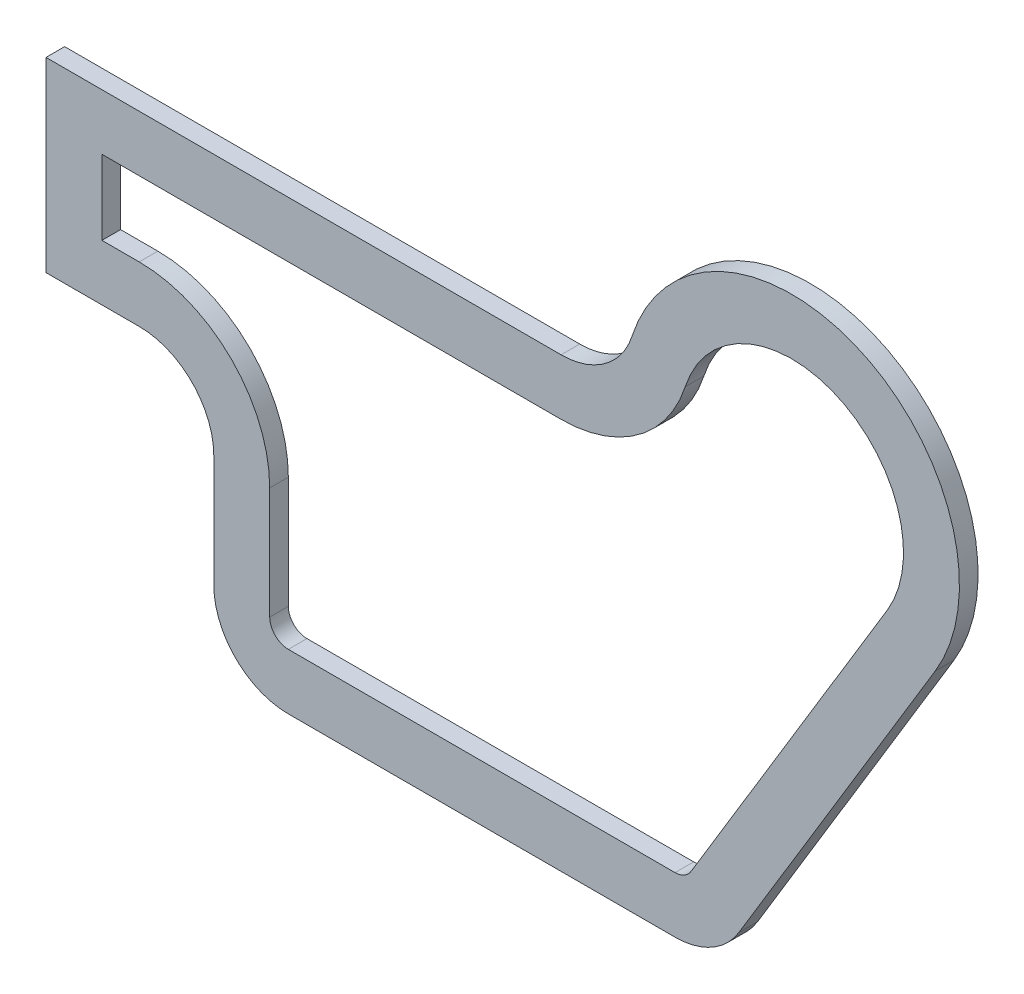
from build123d import *

# Parameters (mm, degrees)
BASE_DEPTH         = 5
CUT_EXTRUDE1_DEPTH = 260.326049598


with BuildPart() as part:
    # Sketch1 → base (new body)
    with BuildSketch(Plane.XY):
        with BuildLine():
            Line((-45, 120), (-45, 70))
            Line((-45, 70), (-20, 70))
            ThreePointArc((-20, 70), (-5.857864376, 64.142135624), (0, 50))
            Line((0, 50), (0, 20))
            ThreePointArc((0, 20), (5.857864376, 5.857864376), (20, 0))
            Line((20, 0), (123.724055084, 0))
            ThreePointArc((123.724055084, 0), (133.546443389, 2.578154863), (140.836467877, 9.647931201))
            Line((140.836467877, 9.647931201), (193.502928783, 96.707845203))
            ThreePointArc((193.502928783, 96.707845203), (173.694009897, 160.933287114), (112.183133888, 133.846153846))
            ThreePointArc((112.183133888, 133.846153846), (104.920383724, 123.827849199), (93.153415616, 120))
            Line((93.153415616, 120), (-45, 120))
        make_face()
    extrude(amount=BASE_DEPTH)

    # Sketch2 → Cut-Extrude1 (cut, through all)
    with BuildSketch(Plane.XY.offset(5)):
        with BuildLine():
            Line((93.153415616, 105), (-30, 105))
            Line((-30, 105), (-30, 85))
            Line((-30, 85), (-20, 85))
            ThreePointArc((-20, 85), (4.748737342, 74.748737342), (15, 50))
            Line((15, 50), (15, 20))
            ThreePointArc((15, 20), (16.464466094, 16.464466094), (20, 15))
            Line((20, 15), (123.724055084, 15))
            ThreePointArc((123.724055084, 15), (126.179652161, 15.644538716), (128.002158282, 17.4119828))
            Line((128.002158282, 17.4119828), (180.668619189, 104.471896802))
            ThreePointArc((180.668619189, 104.471896802), (167.462673265, 147.288858076), (126.455422592, 129.230769231))
            ThreePointArc((126.455422592, 129.230769231), (113.745609805, 111.698736098), (93.153415616, 105))
        make_face()
    extrude(amount=-CUT_EXTRUDE1_DEPTH, mode=Mode.SUBTRACT)


solid = part.part
